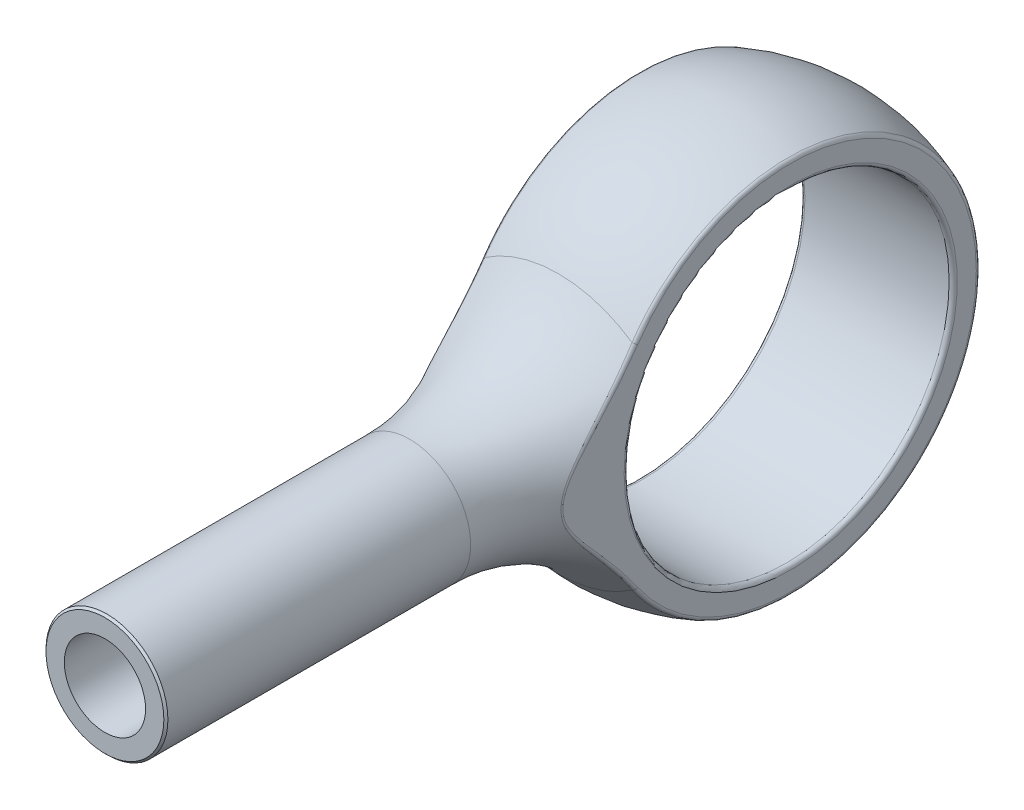
from build123d import *

# Parameters (mm, degrees)
CUT_EXTRUDE2_DEPTH = 10
SKETCH5_R          = 4
CUT_EXTRUDE3_DEPTH = 10
FILLET1_R          = 0.1
SKETCH6_R          = 1
CUT_EXTRUDE4_DEPTH = 5
CHAMFER1_SIZE      = 0.05


with BuildPart() as part:
    # Sketch2 → Revolve1 (revolve)
    with BuildSketch(Plane(origin=(0, 0, 0), x_dir=(1, 0, 0), z_dir=(0, 1, 0))):
        with BuildLine():
            Line((-1.5, -15), (0, -15))
            Line((0, -15), (0, 5))
            ThreePointArc((0, 5), (-4.701618046, 1.701407579), (-3.199747431, -3.8420849))
            ThreePointArc((-3.199747431, -3.8420849), (-1.93956559, -5.480381879), (-1.5, -7.5))
            Line((-1.5, -7.5), (-1.5, -15))
        make_face()
    revolve(axis=Axis((0, 0, -5), (0, 0, 1)))

    # Sketch3 → Cut-Extrude2 (cut, symmetric)
    with BuildSketch(Plane(origin=(0, 0, 0), x_dir=(1, 0, 0), z_dir=(0, 1, 0))):
        with BuildLine():
            Line((1.875, -5.855071388), (1.875, 9.3726866))
            Line((1.875, 9.3726866), (7.480687136, 9.3726866))
            Line((7.480687136, 9.3726866), (7.480687136, -15.437316242))
            Line((7.480687136, -15.437316242), (2.779239779, -8.722953569))
            ThreePointArc((2.779239779, -8.722953569), (2.106415246, -7.358600385), (1.875, -5.855071388))
        make_face()
        with BuildLine():
            Line((-1.875, 9.3726866), (-7.480687136, 9.3726866))
            Line((-7.480687136, 9.3726866), (-7.480687136, -15.437316242))
            Line((-7.480687136, -15.437316242), (-2.779239779, -8.722953569))
            ThreePointArc((-2.779239779, -8.722953569), (-2.106415246, -7.358600385), (-1.875, -5.855071388))
            Line((-1.875, -5.855071388), (-1.875, 9.3726866))
        make_face()
    extrude(amount=CUT_EXTRUDE2_DEPTH, both=True, mode=Mode.SUBTRACT)

    # Sketch5 → Cut-Extrude3 (cut, symmetric)
    with BuildSketch(Plane(origin=(0, 0, 0), x_dir=(0, 0, -1), z_dir=(1, 0, 0))):
        Circle(SKETCH5_R)
    extrude(amount=CUT_EXTRUDE3_DEPTH, both=True, mode=Mode.SUBTRACT)

    # Fillet1
    fillet1_edges = [part.edges().sort_by_distance(p)[0] for p in [
        (-1.875, -1.344126033, 4.829899297),
        (1.875, 0, 5.625682901),
        (1.875, 0, -4.635124054),
        (-1.875, -4.432432466, -1.355698134),
        (1.875, 0, 4),
        (-1.875, 0, 4),
    ]]
    fillet(fillet1_edges, radius=FILLET1_R)

    # Sketch6 → Cut-Extrude4 (cut)
    with BuildSketch(Plane.XY.offset(15)):
        Circle(SKETCH6_R)
    extrude(amount=-CUT_EXTRUDE4_DEPTH, mode=Mode.SUBTRACT)

    # Chamfer1
    chamfer1_edges = [part.edges().sort_by_distance(p)[0] for p in [
        (1.5, 0, 15),
    ]]
    chamfer(chamfer1_edges, length=CHAMFER1_SIZE)


solid = part.part
